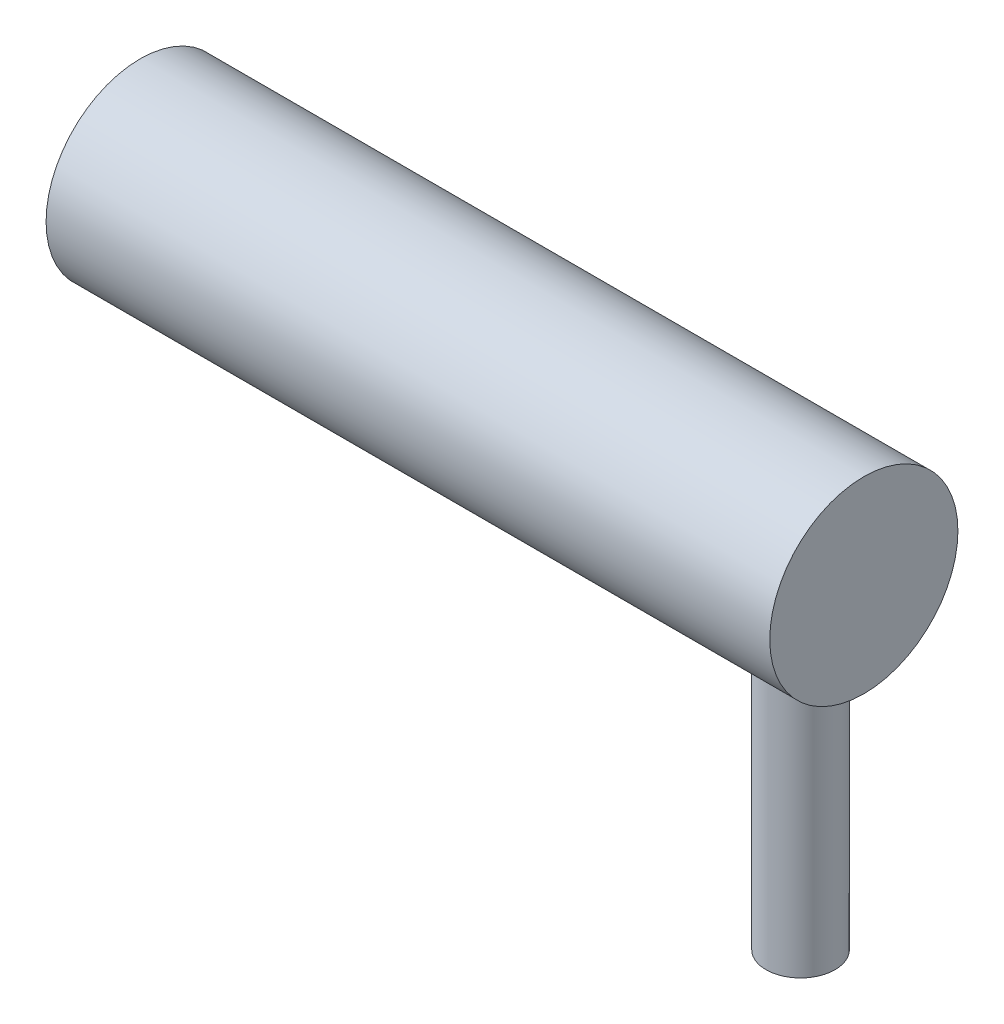
from build123d import *

# Parameters (mm, degrees)
SKETCH1_R           = 26
BOSS_EXTRUDE1_DEPTH = 100
SKETCH2_R           = 9.545827736
BOSS_EXTRUDE2_DEPTH = 70


with BuildPart() as part:
    # Sketch1 → Boss-Extrude1 (new, symmetric)
    with BuildSketch(Plane(origin=(0, 0, 0), x_dir=(0, 0, -1), z_dir=(1, 0, 0))):
        Circle(SKETCH1_R)
    extrude(amount=BOSS_EXTRUDE1_DEPTH, both=True)


with BuildPart() as body_2:
    # Sketch2 → Boss-Extrude2 (new body)
    with BuildSketch(Plane(origin=(0, -26, 0), x_dir=(-1, 0, 0), z_dir=(0, -1, 0))):
        with Locations(Location((-82.502639329, 0, 0), (0, 0, 90))):
            Circle(SKETCH2_R)
    extrude(amount=BOSS_EXTRUDE2_DEPTH)


solid = Compound([part.part, body_2.part])
